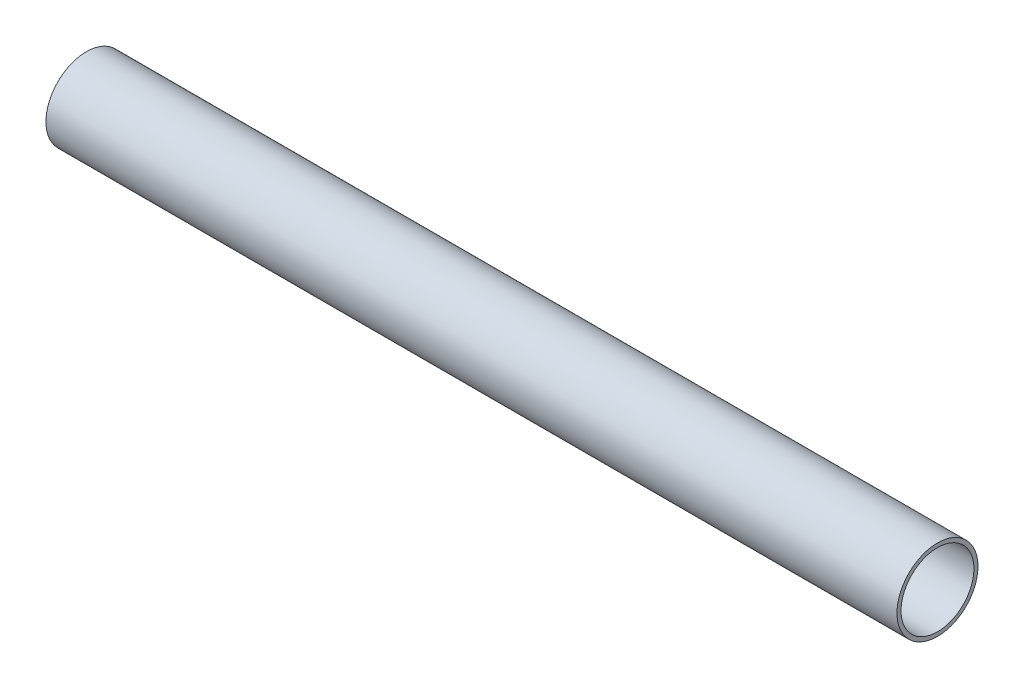
from build123d import *

# Parameters (mm, degrees)
SKETCH1_R           = 15.875
SKETCH1_R_2         = 14.2875
EXTRUDE_THIN1_DEPTH = 166.6875


with BuildPart() as part:
    # Sketch1 → Extrude-Thin1 (new, symmetric)
    with BuildSketch(Plane(origin=(0, 0, 0), x_dir=(0, 0, -1), z_dir=(1, 0, 0))):
        Circle(SKETCH1_R)
        Circle(SKETCH1_R_2, mode=Mode.SUBTRACT)
    extrude(amount=EXTRUDE_THIN1_DEPTH, both=True)


solid = part.part
